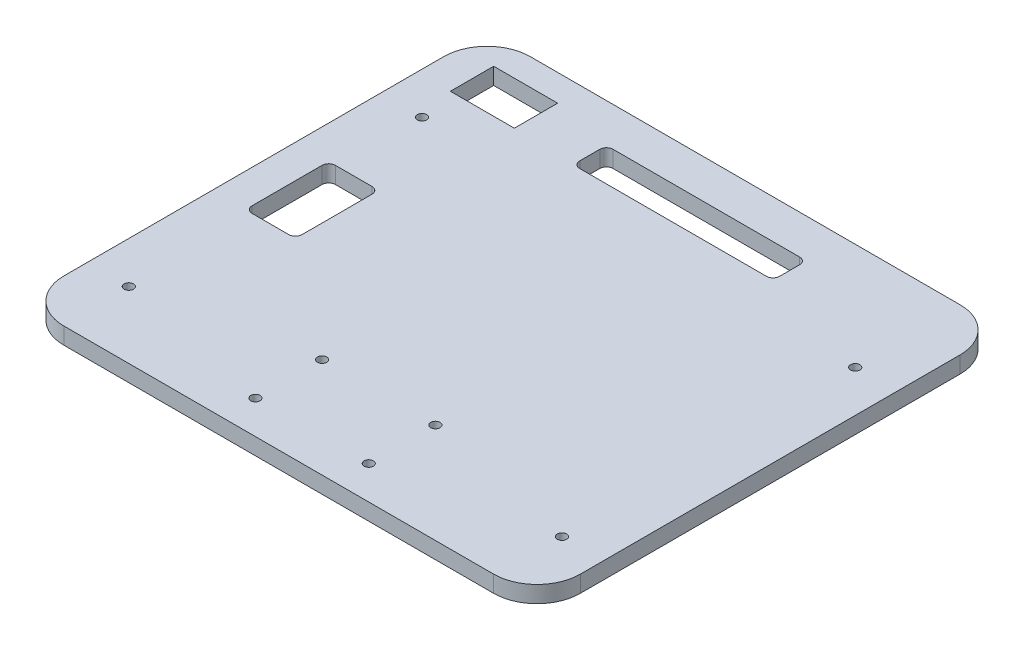
from build123d import *

# Parameters (mm, degrees)
SKETCH1_W           = 155
SKETCH1_H           = 140
BOSS_EXTRUDE1_DEPTH = 5
CUT_EXTRUDE1_DEPTH  = 5
SKETCH3_R           = 1.4
CUT_EXTRUDE2_DEPTH  = 5
SKETCH5_W           = 60
SKETCH5_H           = 10
CUT_EXTRUDE3_DEPTH  = 5
SKETCH6_R           = 1.4
CUT_EXTRUDE4_DEPTH  = 10
SKETCH7_W           = 15
SKETCH7_H           = 25
CUT_EXTRUDE5_DEPTH  = 10
SKETCH8_W           = 19.2
SKETCH8_H           = 13
CUT_EXTRUDE6_DEPTH  = 10
FILLET2_R           = 2
FILLET3_R           = 2


with BuildPart() as part:
    # Sketch1 → Boss-Extrude1 (new body)
    with BuildSketch(Plane(origin=(0, 0, 0), x_dir=(1, 0, 0), z_dir=(0, 1, 0))):
        Rectangle(SKETCH1_W, SKETCH1_H)
    extrude(amount=BOSS_EXTRUDE1_DEPTH)

    # Sketch2 → Cut-Extrude1 (cut)
    with BuildSketch(Plane(origin=(0, 5, 0), x_dir=(1, 0, 0), z_dir=(0, 1, 0))):
        with BuildLine():
            Line((-77.5, 70), (-77.5, 57))
            ThreePointArc((-77.5, 57), (-73.692388155, 66.192388155), (-64.5, 70))
            Line((-64.5, 70), (-77.5, 70))
        make_face()
        with BuildLine():
            Line((77.5, 70), (64.5, 70))
            ThreePointArc((64.5, 70), (73.692388155, 66.192388155), (77.5, 57))
            Line((77.5, 57), (77.5, 70))
        make_face()
        with BuildLine():
            Line((77.5, -70), (77.5, -57))
            ThreePointArc((77.5, -57), (73.692388155, -66.192388155), (64.5, -70))
            Line((64.5, -70), (77.5, -70))
        make_face()
        with BuildLine():
            Line((-77.5, -70), (-64.5, -70))
            ThreePointArc((-64.5, -70), (-73.692388155, -66.192388155), (-77.5, -57))
            Line((-77.5, -57), (-77.5, -70))
        make_face()
    extrude(amount=-CUT_EXTRUDE1_DEPTH, mode=Mode.SUBTRACT)

    # Sketch3 → Cut-Extrude2 (cut)
    with BuildSketch(Plane(origin=(0, 5, 0), x_dir=(1, 0, 0), z_dir=(0, 1, 0))):
        with Locations(Location((-65, 38, 0), (0, 0, 270))):
            Circle(SKETCH3_R)
        with Locations(Location((65, 38, 0), (0, 0, 90))):
            Circle(SKETCH3_R)
        with Locations(Location((65, -50, 0), (0, 0, 270))):
            Circle(SKETCH3_R)
        with Locations(Location((-65, -50, 0), (0, 0, 90))):
            Circle(SKETCH3_R)
    extrude(amount=-CUT_EXTRUDE2_DEPTH, mode=Mode.SUBTRACT)

    # Sketch5 → Cut-Extrude3 (cut)
    with BuildSketch(Plane(origin=(0, 5, 0), x_dir=(1, 0, 0), z_dir=(0, 1, 0))):
        with Locations((0, 53.335629909)):
            Rectangle(SKETCH5_W, SKETCH5_H)
    extrude(amount=-CUT_EXTRUDE3_DEPTH, mode=Mode.SUBTRACT)

    # Sketch6 → Cut-Extrude4 (cut)
    with BuildSketch(Plane(origin=(0, 5, 0), x_dir=(1, 0, 0), z_dir=(0, 1, 0))):
        with Locations(Location((-17, -40, 0), (0, 0, 270))):
            Circle(SKETCH6_R)
        with Locations(Location((17, -40, 0), (0, 0, 270))):
            Circle(SKETCH6_R)
        with Locations(Location((17, -60, 0), (0, 0, 270))):
            Circle(SKETCH6_R)
        with Locations(Location((-17, -60, 0), (0, 0, 270))):
            Circle(SKETCH6_R)
    extrude(amount=-CUT_EXTRUDE4_DEPTH, mode=Mode.SUBTRACT)

    # Sketch7 → Cut-Extrude5 (cut)
    with BuildSketch(Plane(origin=(0, 5, 0), x_dir=(1, 0, 0), z_dir=(0, 1, 0))):
        with Locations((-60, 0)):
            Rectangle(SKETCH7_W, SKETCH7_H)
    extrude(amount=-CUT_EXTRUDE5_DEPTH, mode=Mode.SUBTRACT)

    # Sketch8 → Cut-Extrude6 (cut)
    with BuildSketch(Plane(origin=(0, 5, 0), x_dir=(1, 0, 0), z_dir=(0, 1, 0))):
        with Locations((-57.9, 55.5)):
            Rectangle(SKETCH8_W, SKETCH8_H)
    extrude(amount=-CUT_EXTRUDE6_DEPTH, mode=Mode.SUBTRACT)

    # Fillet2
    fillet2_edges = [part.edges().sort_by_distance(p)[0] for p in [
        (-52.5, 2.5, -12.5),
        (-52.5, 2.5, 12.5),
        (-67.5, 2.5, 12.5),
        (-67.5, 2.5, -12.5),
    ]]
    fillet(fillet2_edges, radius=FILLET2_R)

    # Fillet3
    fillet3_edges = [part.edges().sort_by_distance(p)[0] for p in [
        (30, 2.5, -58.335629909),
        (30, 2.5, -48.335629909),
        (-30, 2.5, -48.335629909),
        (-30, 2.5, -58.335629909),
    ]]
    fillet(fillet3_edges, radius=FILLET3_R)


solid = part.part
